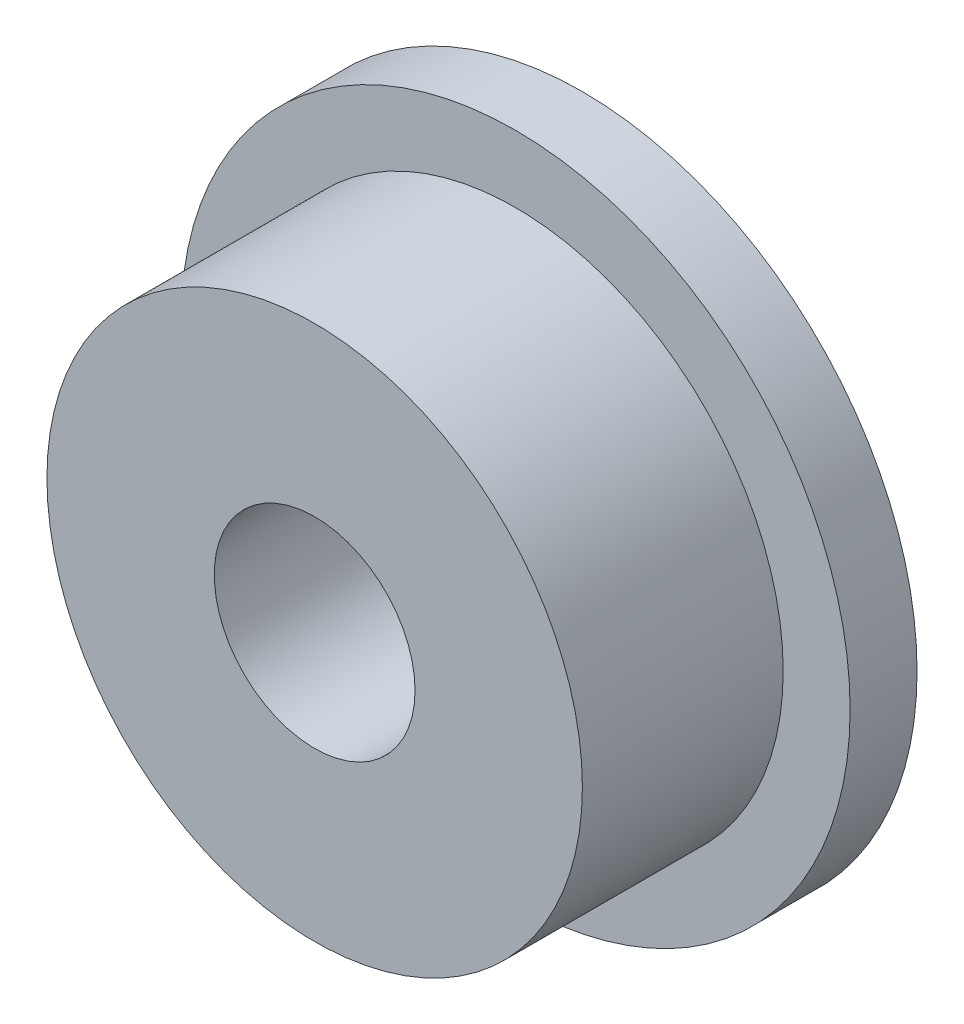
from build123d import *

# Parameters (mm, degrees)
SKETCH_1_R      = 4
SKETCH_1_R_2    = 1.5
EXTRUDE_1_DEPTH = 4
SKETCH_1_4_R    = 5
SKETCH_1_4_R_2  = 1.5
EXTRUDE_3_DEPTH = 1


with BuildPart() as part:
    # 草图1 → 凸台-拉伸1 (new body)
    with BuildSketch(Plane.XY):
        Circle(SKETCH_1_R)
        Circle(SKETCH_1_R_2, mode=Mode.SUBTRACT)
    extrude(amount=EXTRUDE_1_DEPTH)

    # 草图1<4> → 凸台-拉伸3 (add)
    with BuildSketch(Plane.XY):
        Circle(SKETCH_1_4_R)
        Circle(SKETCH_1_4_R_2, mode=Mode.SUBTRACT)
    extrude(amount=EXTRUDE_3_DEPTH)


solid = part.part
